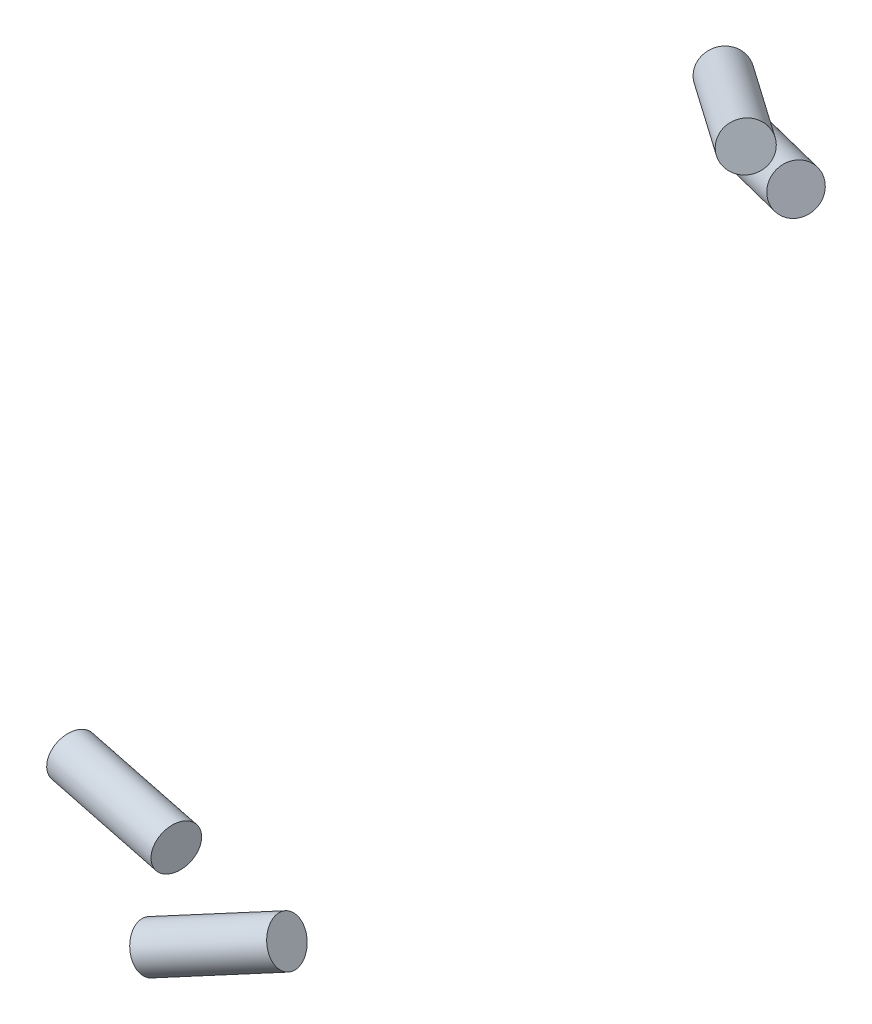
from build123d import *

# Parameters (mm, degrees)
SUSP_RR_ROCKER_BRACKET_A_PROFILE_R   = 7
SUSP_RR_ROCKER_BRACKET_B_PROFILE_R   = 7
SUSP_RR_COILOVER_BRACKET_A_PROFILE_R = 7
SUSP_RR_COILOVER_BRACKET_B_PROFILE_R = 7


with BuildPart() as part:
    # SUSP_RR_rocker_bracket_a: sweep along a curve in space
    with BuildLine() as susp_rr_rocker_bracket_a_path:
        Line((217.967798, 1156.31916, -69.0971306), (259.065027, 1155.1096, -61.5712018))
    # SUSP_RR_rocker_bracket_a profile (on start of the path) → SUSP_RR_rocker_bracket_a (sweep)
    with BuildSketch(Plane(origin=(217.967798, 1156.31916, -69.0971306), x_dir=(-0.18012957419404588, 0, 0.9836428907386419), z_dir=(0.9832309457336401, -0.028938126770580858, 0.18005413677764104))):
        Circle(SUSP_RR_ROCKER_BRACKET_A_PROFILE_R)
    sweep(path=susp_rr_rocker_bracket_a_path.line)


with BuildPart() as body_2:
    # SUSP_RR_rocker_bracket_b: sweep along a curve in space
    with BuildLine() as susp_rr_rocker_bracket_b_path:
        Line((231.564969, 1104.02989, -80.5982665), (268.814973, 1120.8704, -87.4287982))
    # SUSP_RR_rocker_bracket_b profile (on start of the path) → SUSP_RR_rocker_bracket_b (sweep)
    with BuildSketch(Plane(origin=(231.564969, 1104.02989, -80.5982665), x_dir=(-0.41195094092127316, 0.9112060262498695, 0), z_dir=(0.8987466334179565, 0.4063181219401058, -0.16480313317092873))):
        Circle(SUSP_RR_ROCKER_BRACKET_B_PROFILE_R)
    sweep(path=susp_rr_rocker_bracket_b_path.line)


with BuildPart() as body_3:
    # SUSP_RR_coilover_bracket_a: sweep along a curve in space
    with BuildLine() as susp_rr_coilover_bracket_a_path:
        Line((238.279774, 1261.68448, -258.540964), (272.150503, 1271.95544, -231.779774))
    # SUSP_RR_coilover_bracket_a profile (on start of the path) → SUSP_RR_coilover_bracket_a (sweep)
    with BuildSketch(Plane(origin=(238.279774, 1261.68448, -258.540964), x_dir=(-0.6199459454957336, 0, 0.7846445212090639), z_dir=(0.7633345136071678, 0.2314735610172051, 0.6031089544071807))):
        Circle(SUSP_RR_COILOVER_BRACKET_A_PROFILE_R)
    sweep(path=susp_rr_coilover_bracket_a_path.line)


with BuildPart() as body_4:
    # SUSP_RR_coilover_bracket_b: sweep along a curve in space
    with BuildLine() as susp_rr_coilover_bracket_b_path:
        Line((243.984676, 1245.82104, -259.67307), (276.582297, 1256.39216, -243.533226))
    # SUSP_RR_coilover_bracket_b profile (on start of the path) → SUSP_RR_coilover_bracket_b (sweep)
    with BuildSketch(Plane(origin=(243.984676, 1245.82104, -259.67307), x_dir=(-0.4437139540554131, 0, 0.8961684701977138), z_dir=(0.8605635597184917, 0.2790731463934563, 0.42608513075052806))):
        Circle(SUSP_RR_COILOVER_BRACKET_B_PROFILE_R)
    sweep(path=susp_rr_coilover_bracket_b_path.line)


solid = Compound([part.part, body_2.part, body_3.part, body_4.part])
